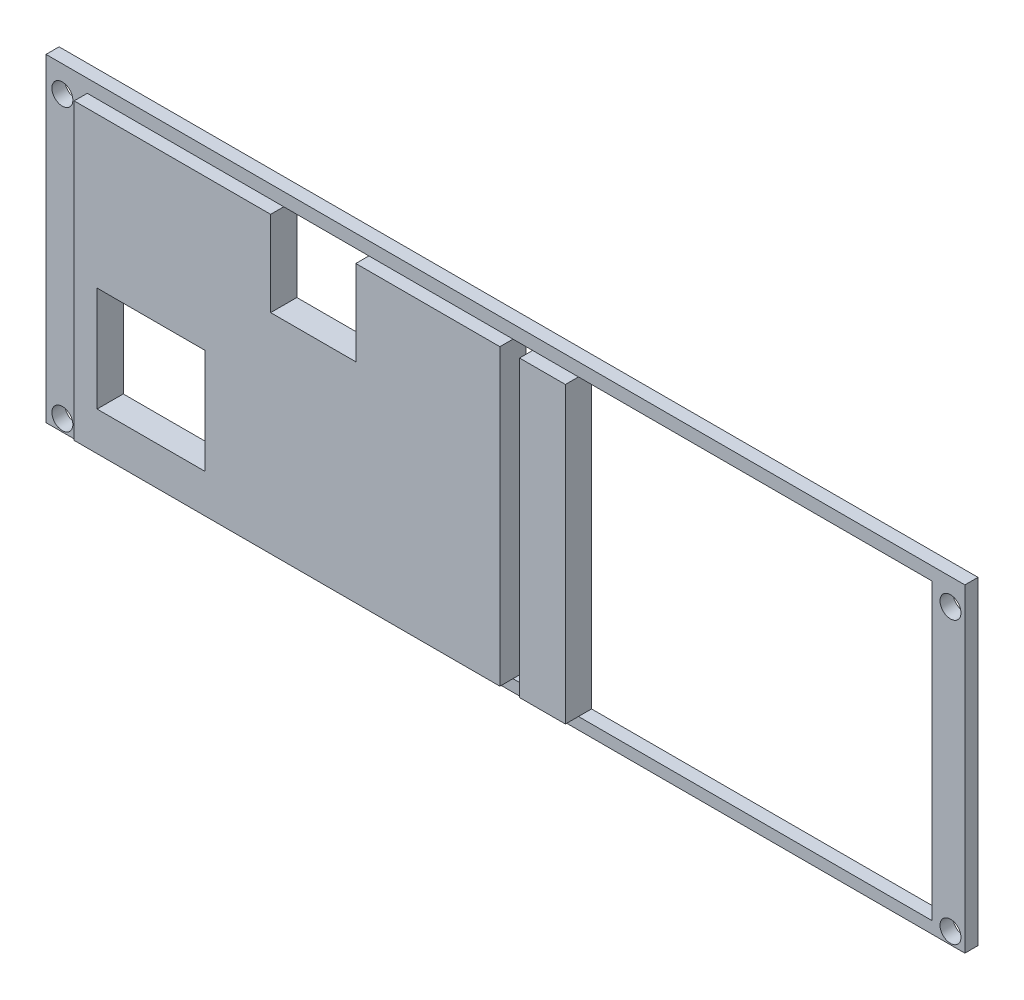
from build123d import *

# Parameters (mm, degrees)
SKETCH_2_W               = 140.3
SKETCH_2_H               = 48.7
EXTRUDE_1_DEPTH          = 4
SKETCH_3_W               = 140.3
SKETCH_3_H               = 48.7
SKETCH_3_R               = 1.6
SKETCH_3_W_2             = 129
SKETCH_3_H_2             = 44.9
CUT_EXTRUDE_1_DEPTH      = 2
SKETCH_6_W               = 54
SKETCH_6_H               = 44.9
SKETCH_6_W_2             = 3
SKETCH_6_W_3             = 13
SKETCH_6_H_2             = 13
SKETCH_6_W_4             = 10
SKETCH_6_H_3             = 16
SKETCH_6_R               = 1.6
CUT_EXTRUDE_2_DEPTH      = 149.565743023
CUT_EXTRUDE_3_DEPTH      = 149.565743023
CUT_EXTRUDE_3_DEPTH_BACK = 10
SKETCH_7_W               = 6.5
SKETCH_7_H               = 16


with BuildPart() as part:
    # 草图2 → 凸台-拉伸1 (new body)
    with BuildSketch(Plane.XY):
        with Locations((70.15, 24.35)):
            Rectangle(SKETCH_2_W, SKETCH_2_H)
    extrude(amount=EXTRUDE_1_DEPTH)

    # 草图3 → 切除-拉伸1 (cut)
    with BuildSketch(Plane.XY.offset(4)):
        with Locations((70.15, 24.35)):
            Rectangle(SKETCH_3_W, SKETCH_3_H)
        with Locations((138.1, 1.8)):
            Circle(SKETCH_3_R, mode=Mode.SUBTRACT)
        with Locations((138.1, 44.7)):
            Circle(SKETCH_3_R, mode=Mode.SUBTRACT)
        with Locations((2.5, 1.8)):
            Circle(SKETCH_3_R, mode=Mode.SUBTRACT)
        with Locations((2.5, 44.7)):
            Circle(SKETCH_3_R, mode=Mode.SUBTRACT)
        with Locations((70.8, 24.25)):
            Rectangle(SKETCH_3_W_2, SKETCH_3_H_2, mode=Mode.SUBTRACT)
    extrude(amount=-CUT_EXTRUDE_1_DEPTH, mode=Mode.SUBTRACT)

    # 草图6 → 切除-拉伸2 (cut, through all)
    with BuildSketch(Plane.XY.offset(4)):
        with Locations((108.3, 24.25)):
            Rectangle(SKETCH_6_W, SKETCH_6_H)
        with Locations((72.8, 24.25)):
            Rectangle(SKETCH_6_W_2, SKETCH_6_H)
        with Locations((42.8, 40.2)):
            Rectangle(SKETCH_6_W_3, SKETCH_6_H_2)
        with Locations((21.3, 15.7)):
            Rectangle(SKETCH_6_W_4, SKETCH_6_H_3)
        with Locations((2.5, 44.7)):
            Circle(SKETCH_6_R)
        with Locations((2.5, 1.8)):
            Circle(SKETCH_6_R)
        with Locations((138.1, 44.7)):
            Circle(SKETCH_6_R)
        with Locations((138.1, 1.8)):
            Circle(SKETCH_6_R)
    extrude(amount=-CUT_EXTRUDE_2_DEPTH, mode=Mode.SUBTRACT)

    # 草图7 → 切除-拉伸3 (cut, two sides: drawn at the far end of the back side and taken through both)
    with BuildSketch(Plane(origin=(0, 0, 0), x_dir=(-1, 0, 0), z_dir=(0, 0, -1)).offset(-CUT_EXTRUDE_3_DEPTH_BACK)):
        with Locations((-13.05, 15.7)):
            Rectangle(SKETCH_7_W, SKETCH_7_H)
    extrude(amount=CUT_EXTRUDE_3_DEPTH + CUT_EXTRUDE_3_DEPTH_BACK, mode=Mode.SUBTRACT)


solid = part.part
